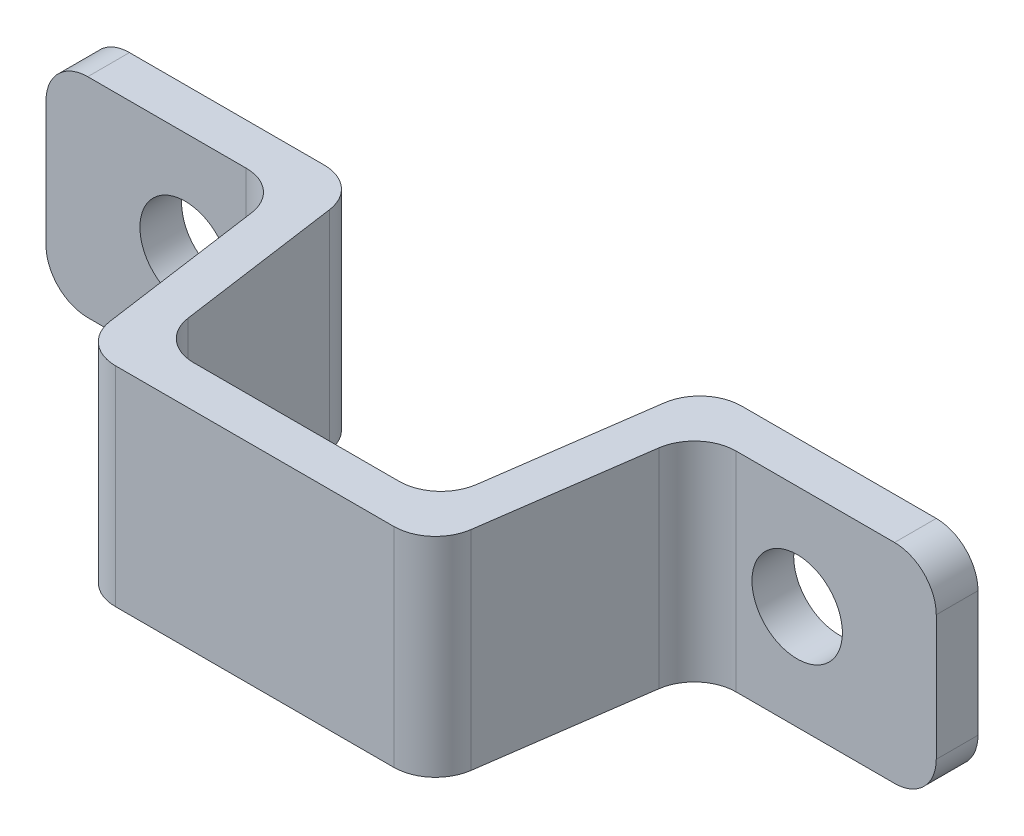
from build123d import *

# Parameters (mm, degrees)
EXTRUDE_1_DEPTH     = 7.5
SKETCH_2_R          = 3.25
CUT_EXTRUDE_1_DEPTH = 38.003378224
FILLET_1_R          = 3
FILLET_2_R          = 3


with BuildPart() as part:
    # 草图1 → 凸台-拉伸1 (new, symmetric)
    with BuildSketch(Plane(origin=(0, 0, 0), x_dir=(1, 0, 0), z_dir=(0, 1, 0))):
        Polygon((-12.607332667, 0), (12.607332667, 0), (15, 17), (32, 17), (32, 20), (12.392667333, 20), (10, 3), (-10, 3), (-12.392667333, 20), (-32, 20), (-32, 17), (-15, 17), align=None)
    extrude(amount=EXTRUDE_1_DEPTH, both=True)

    # 草图2 → 切除-拉伸1 (cut, through all)
    with BuildSketch(Plane.XY.offset(-17)):
        with Locations((-22, 0)):
            Circle(SKETCH_2_R)
        with Locations(Location((22, 0, 0), (0, 0, 180))):
            Circle(SKETCH_2_R)
    extrude(amount=-CUT_EXTRUDE_1_DEPTH, mode=Mode.SUBTRACT)

    # 圆角1
    fillet_1_edges = [part.edges().sort_by_distance(p)[0] for p in [
        (15, 0, -17),
        (12.607332667, 0, 0),
        (-12.607332667, 0, 0),
        (-15, 0, -17),
        (-12.392667333, 0, -20),
        (-10, 0, -3),
        (10, 0, -3),
        (12.392667333, 0, -20),
    ]]
    fillet(fillet_1_edges, radius=FILLET_1_R)

    # 圆角2
    fillet_2_edges = [part.edges().sort_by_distance(p)[0] for p in [
        (-32, -7.5, -18.5),
        (32, -7.5, -18.5),
        (-32, 7.5, -18.5),
        (32, 7.5, -18.5),
    ]]
    fillet(fillet_2_edges, radius=FILLET_2_R)


solid = part.part
